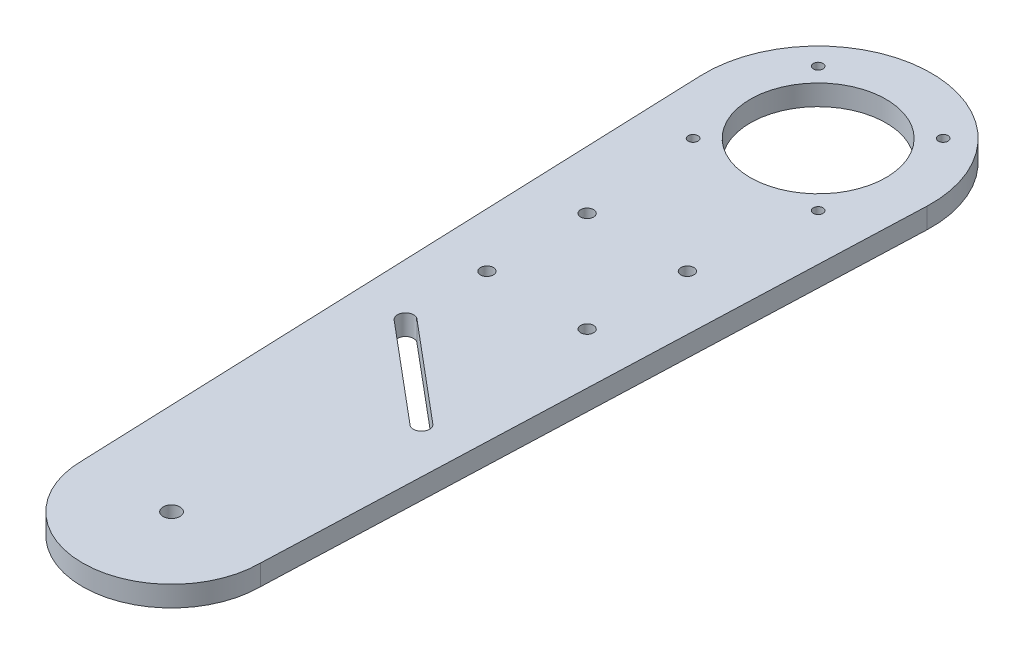
from build123d import *

# Parameters (mm, degrees)
BOSS_EXTRUDE1_DEPTH     = 6.35
SKETCH2_R               = 2.6
CUT_EXTRUDE1_DEPTH      = 238.676928834
ESQUISSE3_R             = 21
ENL_V_MAT_EXTRU_2_DEPTH = 238.676928834
ESQUISSE7_R             = 1.5
ENL_V_MAT_EXTRU_3_DEPTH = 238.676928834
CUT_EXTRUDE3_DEPTH      = 238.676928834
SKETCH5_R               = 2
CUT_EXTRUDE4_DEPTH      = 238.676928834
SKETCH6_R               = 2
CUT_EXTRUDE5_DEPTH      = 238.676928834


with BuildPart() as part:
    # Sketch1 → Boss-Extrude1 (new body)
    with BuildSketch(Plane(origin=(0, 0, 0), x_dir=(1, 0, 0), z_dir=(0, 1, 0))):
        with BuildLine():
            Line((27.5, 0), (34.975254116, 198.684097441))
            ThreePointArc((34.975254116, 198.684097441), (0, 235), (-34.975254116, 198.684097441))
            Line((-34.975254116, 198.684097441), (-27.5, 0))
            ThreePointArc((-27.5, 0), (0, -27.5), (27.5, 0))
        make_face()
    extrude(amount=BOSS_EXTRUDE1_DEPTH)

    # Sketch2 → Cut-Extrude1 (cut, through all)
    with BuildSketch(Plane(origin=(0, 6.35, 0), x_dir=(1, 0, 0), z_dir=(0, 1, 0))):
        with Locations(Location((0, 0, 0), (0, 0, 270))):
            Circle(SKETCH2_R)
    extrude(amount=-CUT_EXTRUDE1_DEPTH, mode=Mode.SUBTRACT)

    # Esquisse3 → Enlèv. mat.-Extru.2 (cut, through all)
    with BuildSketch(Plane(origin=(0, 6.35, 0), x_dir=(1, 0, 0), z_dir=(0, 1, 0))):
        with Locations(Location((0, 200, 0), (0, 0, 270))):
            Circle(ESQUISSE3_R)
    extrude(amount=-ENL_V_MAT_EXTRU_2_DEPTH, mode=Mode.SUBTRACT)

    # Esquisse7 → Enlèv. mat.-Extru.3 (cut, through all)
    with BuildSketch(Plane(origin=(0, 6.35, 0), x_dir=(1, 0, 0), z_dir=(0, 1, 0))):
        with Locations(Location((-19.339370465, 219.339370465, 0), (0, 0, 270))):
            Circle(ESQUISSE7_R)
        with Locations(Location((19.339370465, 219.339370465, 0), (0, 0, 270))):
            Circle(ESQUISSE7_R)
        with Locations(Location((19.339370465, 180.660629535, 0), (0, 0, 270))):
            Circle(ESQUISSE7_R)
        with Locations(Location((-19.339370465, 180.660629535, 0), (0, 0, 270))):
            Circle(ESQUISSE7_R)
    extrude(amount=-ENL_V_MAT_EXTRU_3_DEPTH, mode=Mode.SUBTRACT)

    # Sketch4 → Cut-Extrude3 (cut, through all)
    with BuildSketch(Plane(origin=(0, 6.35, 0), x_dir=(1, 0, 0), z_dir=(0, 1, 0))):
        with BuildLine():
            Line((13.713919838, 60.073384505), (-16.927857887, 85.784888892))
            ThreePointArc((-16.927857887, 85.784888892), (-17.23599997, 89.306969024), (-13.713919838, 89.615111108))
            Line((-13.713919838, 89.615111108), (16.927857887, 63.90360672))
            ThreePointArc((16.927857887, 63.90360672), (17.23599997, 60.381526588), (13.713919838, 60.073384505))
        make_face()
    extrude(amount=-CUT_EXTRUDE3_DEPTH, mode=Mode.SUBTRACT)

    # Sketch5 → Cut-Extrude4 (cut, through all)
    with BuildSketch(Plane.XZ):
        with Locations(Location((-15.65, -113.2, 0), (0, 0, 90))):
            Circle(SKETCH5_R)
        with Locations(Location((15.35, -113.2, 0), (0, 0, 90))):
            Circle(SKETCH5_R)
        with Locations(Location((15.35, -144.2, 0), (0, 0, 90))):
            Circle(SKETCH5_R)
    extrude(amount=-CUT_EXTRUDE4_DEPTH, mode=Mode.SUBTRACT)

    # Sketch6 → Cut-Extrude5 (cut, through all)
    with BuildSketch(Plane(origin=(0, 6.35, 0), x_dir=(1, 0, 0), z_dir=(0, 1, 0))):
        with Locations(Location((-15.65, 144.2, 0), (0, 0, 270))):
            Circle(SKETCH6_R)
        with Locations(Location((-15.65, 113.2, 0), (0, 0, 270))):
            Circle(SKETCH6_R)
        with Locations(Location((15.35, 113.2, 0), (0, 0, 270))):
            Circle(SKETCH6_R)
        with Locations(Location((15.35, 144.2, 0), (0, 0, 270))):
            Circle(SKETCH6_R)
    extrude(amount=-CUT_EXTRUDE5_DEPTH, mode=Mode.SUBTRACT)


solid = part.part
